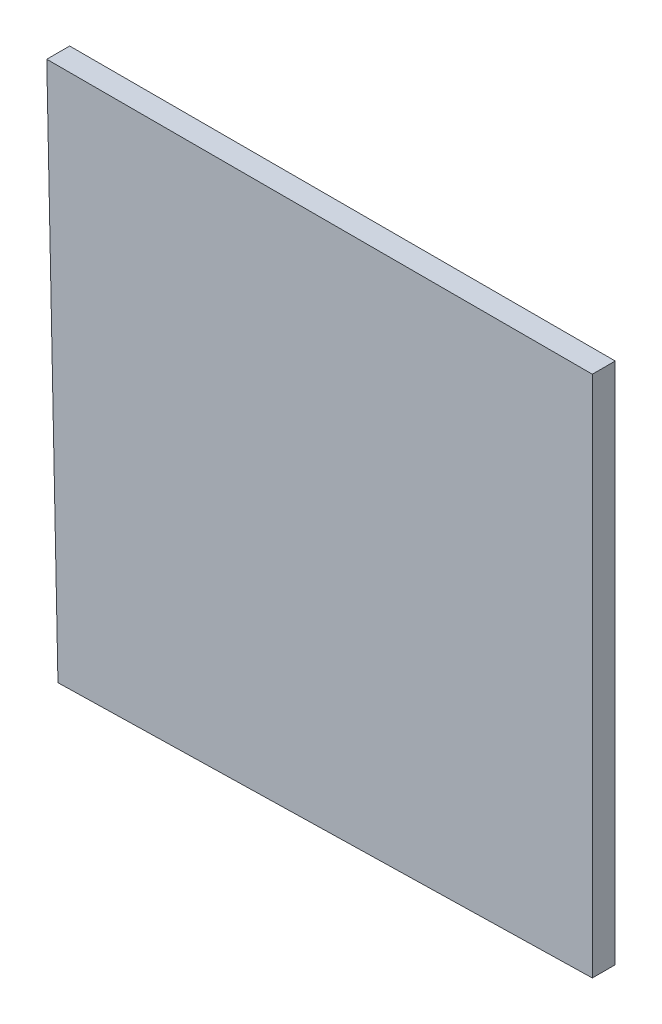
from build123d import *

# Parameters (mm, degrees)
BOSS_EXTRU_1_DEPTH = 10


with BuildPart() as part:
    # Esquisse1 → Boss.-Extru.1 (new body)
    with BuildSketch(Plane.XY):
        Polygon((-103.557324721, 82.615483871), (134.682675279, 82.615483871), (134.682675279, -145.724516129), (-98.667324721, -150.734516129), align=None)
    extrude(amount=BOSS_EXTRU_1_DEPTH)


solid = part.part
